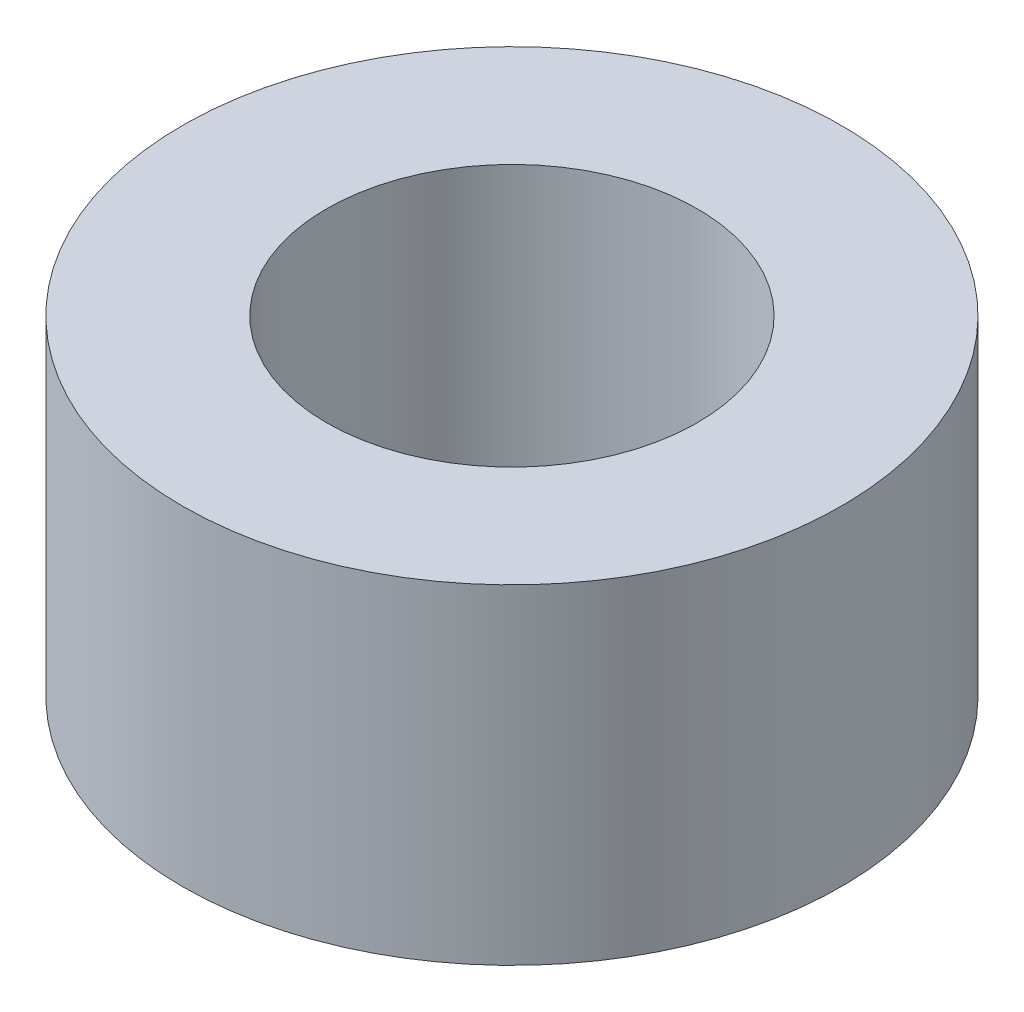
from build123d import *

# Parameters (mm, degrees)
SKETCH_1_R      = 4
SKETCH_1_R_2    = 2.25
EXTRUDE_1_DEPTH = 4


with BuildPart() as part:
    # Эскиз1 → Бобышка-Вытянуть1 (new body)
    with BuildSketch(Plane(origin=(0, 0, 0), x_dir=(1, 0, 0), z_dir=(0, 1, 0))):
        with Locations(Location((0, 0, 0), (0, 0, 270))):
            Circle(SKETCH_1_R)
        with Locations(Location((0, 0, 0), (0, 0, 270))):
            Circle(SKETCH_1_R_2, mode=Mode.SUBTRACT)
    extrude(amount=EXTRUDE_1_DEPTH)


solid = part.part
